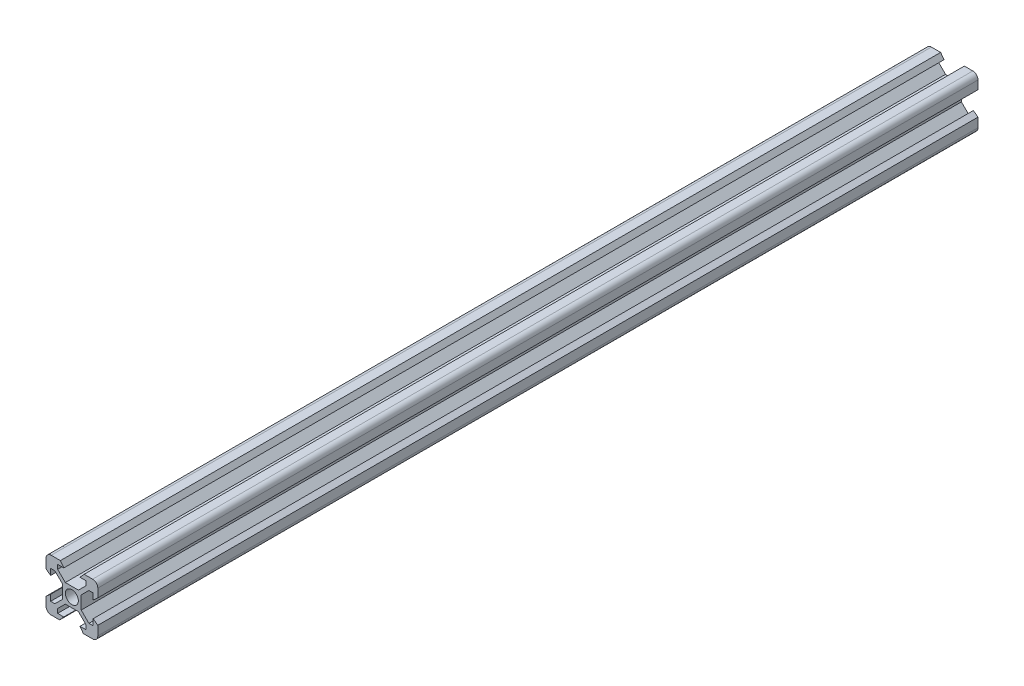
from build123d import *

# Parameters (mm, degrees)
SKETCH1_R           = 2.5
BOSS_EXTRUDE1_DEPTH = 340


with BuildPart() as part:
    # Sketch1 → Boss-Extrude1 (new body)
    with BuildSketch(Plane.XY):
        with BuildLine():
            Line((-4.725542729, -10), (-3.125, -8.2))
            Line((-3.125, -8.2), (-5.5, -8.2))
            Line((-5.5, -8.2), (-5.5, -6.560660172))
            Line((-5.5, -6.560660172), (-2.539339828, -3.6))
            Line((-2.539339828, -3.6), (2.539339828, -3.6))
            Line((2.539339828, -3.6), (5.5, -6.560660172))
            Line((5.5, -6.560660172), (5.5, -8.2))
            Line((5.5, -8.2), (3.125, -8.2))
            Line((3.125, -8.2), (4.434457271, -10))
            Line((4.434457271, -10), (8, -10))
            ThreePointArc((8, -10), (9.414213562, -9.414213562), (10, -8))
            Line((10, -8), (10, -4.434457271))
            Line((10, -4.434457271), (8.2, -3.125))
            Line((8.2, -3.125), (8.2, -5.5))
            Line((8.2, -5.5), (6.560660172, -5.5))
            Line((6.560660172, -5.5), (3.6, -2.539339828))
            Line((3.6, -2.539339828), (3.6, 2.539339828))
            Line((3.6, 2.539339828), (6.560660172, 5.5))
            Line((6.560660172, 5.5), (8.2, 5.5))
            Line((8.2, 5.5), (8.2, 3.125))
            Line((8.2, 3.125), (10, 4.725542729))
            Line((10, 4.725542729), (10, 8))
            ThreePointArc((10, 8), (9.414213562, 9.414213562), (8, 10))
            Line((8, 10), (4.725542729, 10))
            Line((4.725542729, 10), (3.125, 8.2))
            Line((3.125, 8.2), (5.5, 8.2))
            Line((5.5, 8.2), (5.5, 6.560660172))
            Line((5.5, 6.560660172), (2.539339828, 3.6))
            Line((2.539339828, 3.6), (-2.539339828, 3.6))
            Line((-2.539339828, 3.6), (-5.5, 6.560660172))
            Line((-5.5, 6.560660172), (-5.5, 8.2))
            Line((-5.5, 8.2), (-3.125, 8.2))
            Line((-3.125, 8.2), (-4.434457271, 10))
            Line((-4.434457271, 10), (-8, 10))
            ThreePointArc((-8, 10), (-9.414213562, 9.414213562), (-10, 8))
            Line((-10, 8), (-10, 4.434457271))
            Line((-10, 4.434457271), (-8.2, 3.125))
            Line((-8.2, 3.125), (-8.2, 5.5))
            Line((-8.2, 5.5), (-6.560660172, 5.5))
            Line((-6.560660172, 5.5), (-3.6, 2.539339828))
            Line((-3.6, 2.539339828), (-3.6, -2.539339828))
            Line((-3.6, -2.539339828), (-6.560660172, -5.5))
            Line((-6.560660172, -5.5), (-8.2, -5.5))
            Line((-8.2, -5.5), (-8.2, -3.125))
            Line((-8.2, -3.125), (-10, -4.725542729))
            Line((-10, -4.725542729), (-10, -8))
            ThreePointArc((-10, -8), (-9.414213562, -9.414213562), (-8, -10))
            Line((-8, -10), (-4.725542729, -10))
        make_face()
        Circle(SKETCH1_R, mode=Mode.SUBTRACT)
    extrude(amount=BOSS_EXTRUDE1_DEPTH)


solid = part.part
